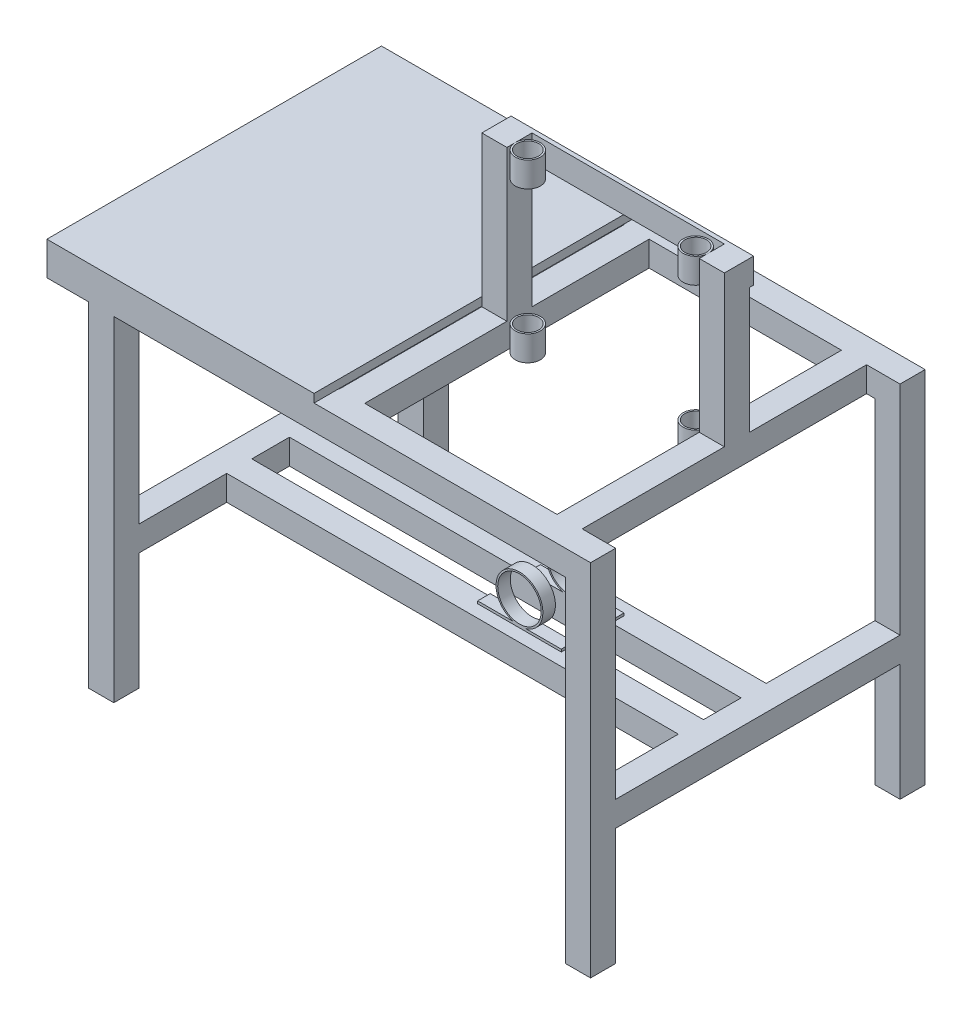
from build123d import *

# Parameters (mm, degrees)
SKETCH4_W              = 600
SKETCH4_H              = 400
SKETCH4_W_2            = 540
SKETCH4_H_2            = 340
BOSS_EXTRUDE2_DEPTH    = 30
SKETCH10_W             = 30
SKETCH10_H             = 30
BOSS_EXTRUDE7_DEPTH    = 370
SKETCH17_W             = 30
SKETCH17_H             = 30
BOSS_EXTRUDE13_DEPTH   = 500
SKETCH18_W             = 30
SKETCH18_H             = 30
BOSS_EXTRUDE14_DEPTH   = 370
SKETCH19_W             = 30
SKETCH19_H             = 30
BOSS_EXTRUDE15_DEPTH   = 570
SKETCH21_R             = 26
BOSS_EXTRUDE17_DEPTH   = 15
BOSS_EXTRUDE18_START   = -15
SKETCH22_R             = 26
BOSS_EXTRUDE18_DEPTH   = 15
SKETCH23_W             = 30
SKETCH23_H             = 30
CUT_EXTRUDE2_DEPTH     = 100
SKETCH27_W             = 30
SKETCH27_H             = 30
BOSS_EXTRUDE22_DEPTH   = 340
SKETCH28_W             = 30
SKETCH28_H             = 30
BOSS_EXTRUDE23_DEPTH   = 180
SKETCH31_R             = 15
SKETCH31_R_2           = 13
BOSS_EXTRUDE24_DEPTH   = 30
BOSS_EXTRUDE24_2_DEPTH = 30
SKETCH34_R             = 15
SKETCH34_R_2           = 13
BOSS_EXTRUDE25_DEPTH   = 30
BOSS_EXTRUDE25_2_DEPTH = 30
SKETCH35_W             = 30
SKETCH35_H             = 30
CUT_EXTRUDE3_DEPTH     = 340
SKETCH36_W             = 30
SKETCH36_H             = 30
CUT_EXTRUDE4_DEPTH     = 340
SKETCH37_W             = 30
SKETCH37_H             = 30
BOSS_EXTRUDE26_DEPTH   = 50
SKETCH38_W             = 30
SKETCH38_H             = 30
BOSS_EXTRUDE27_DEPTH   = 340
SKETCH39_W             = 319.396071149
SKETCH39_H             = 400
BOSS_EXTRUDE28_DEPTH   = 10
SKETCH42_W             = 290
SKETCH42_H             = 30
BOSS_EXTRUDE31_DEPTH   = 5


with BuildPart() as part:
    # Sketch4 → Boss-Extrude2 (new body)
    with BuildSketch(Plane(origin=(0, 0, 0), x_dir=(1, 0, 0), z_dir=(0, 1, 0))):
        Rectangle(SKETCH4_W, SKETCH4_H)
        Rectangle(SKETCH4_W_2, SKETCH4_H_2, mode=Mode.SUBTRACT)
    extrude(amount=BOSS_EXTRUDE2_DEPTH)

    # Sketch10 → Boss-Extrude7 (add)
    with BuildSketch(Plane.XY.offset(200)):
        with Locations((-15, 15)):
            Rectangle(SKETCH10_W, SKETCH10_H)
    extrude(amount=-BOSS_EXTRUDE7_DEPTH)

    # Sketch17 → Boss-Extrude13 (add)
    with BuildSketch(Plane.XZ):
        with Locations((-285, 185)):
            Rectangle(SKETCH17_W, SKETCH17_H)
        with Locations((285, 185)):
            Rectangle(SKETCH17_W, SKETCH17_H)
        with Locations((285, -185)):
            Rectangle(SKETCH17_W, SKETCH17_H)
        with Locations((-285, -185)):
            Rectangle(SKETCH17_W, SKETCH17_H)
    extrude(amount=BOSS_EXTRUDE13_DEPTH)

    # Sketch18 → Boss-Extrude14 (add)
    with BuildSketch(Plane.XY.offset(200)):
        with Locations((285, -245)):
            Rectangle(SKETCH18_W, SKETCH18_H)
        with Locations((-285, -245)):
            Rectangle(SKETCH18_W, SKETCH18_H)
    extrude(amount=-BOSS_EXTRUDE14_DEPTH)

    # Sketch19 → Boss-Extrude15 (add)
    with BuildSketch(Plane.ZY.offset(300)):
        with Locations((-25, -245)):
            Rectangle(SKETCH19_W, SKETCH19_H)
        with Locations((50, -245)):
            Rectangle(SKETCH19_W, SKETCH19_H)
    extrude(amount=-BOSS_EXTRUDE15_DEPTH)

    # Sketch21 → Boss-Extrude17 (add)
    with BuildSketch(Plane.XY.offset(-10)):
        with BuildLine():
            Line((72.416198487, -227), (115, -227))
            Line((115, -227), (115, -233))
            Line((115, -233), (15, -233))
            Line((15, -233), (15, -227))
            Line((15, -227), (57.583801513, -227))
            ThreePointArc((57.583801513, -227), (65, -172), (72.416198487, -227))
        make_face()
        with Locations((65, -200)):
            Circle(SKETCH21_R, mode=Mode.SUBTRACT)
    extrude(amount=-BOSS_EXTRUDE17_DEPTH)

    # Sketch22 → Boss-Extrude18 (add)
    with BuildSketch(Plane(origin=(0, 0, 35), x_dir=(-1, 0, 0), z_dir=(0, 0, -1)).offset(BOSS_EXTRUDE18_START)):
        with BuildLine():
            Line((-57.583801513, -227), (-15, -227))
            Line((-15, -227), (-15, -230))
            Line((-15, -230), (-115, -230))
            Line((-115, -230), (-115, -227))
            Line((-115, -227), (-72.416198487, -227))
            ThreePointArc((-72.416198487, -227), (-65, -172), (-57.583801513, -227))
        make_face()
        with Locations(Location((-65, -200, 0), (0, 0, 180))):
            Circle(SKETCH22_R, mode=Mode.SUBTRACT)
    extrude(amount=BOSS_EXTRUDE18_DEPTH)

    # Sketch23 → Cut-Extrude2 (cut)
    with BuildSketch(Plane.XZ.offset(500)):
        with Locations((-285, 185)):
            Rectangle(SKETCH23_W, SKETCH23_H)
        with Locations((285, 185)):
            Rectangle(SKETCH23_W, SKETCH23_H)
        with Locations((285, -185)):
            Rectangle(SKETCH23_W, SKETCH23_H)
        with Locations((-285, -185)):
            Rectangle(SKETCH23_W, SKETCH23_H)
    extrude(amount=-CUT_EXTRUDE2_DEPTH, mode=Mode.SUBTRACT)

    # Sketch27 → Boss-Extrude22 (add)
    with BuildSketch(Plane.XY.offset(-170)):
        with Locations((245, 15)):
            Rectangle(SKETCH27_W, SKETCH27_H)
    extrude(amount=BOSS_EXTRUDE22_DEPTH)

    # Sketch28 → Boss-Extrude23 (add)
    with BuildSketch(Plane(origin=(0, 30, 0), x_dir=(1, 0, 0), z_dir=(0, 1, 0))):
        with Locations((-15, 15)):
            Rectangle(SKETCH28_W, SKETCH28_H)
        with Locations((245, 15)):
            Rectangle(SKETCH28_W, SKETCH28_H)
    extrude(amount=BOSS_EXTRUDE23_DEPTH)

    # Sketch35 → Cut-Extrude3 (cut)
    with BuildSketch(Plane.XY.offset(-170)):
        with Locations((285, 15)):
            Rectangle(SKETCH35_W, SKETCH35_H)
    extrude(amount=CUT_EXTRUDE3_DEPTH, mode=Mode.SUBTRACT)

    # Sketch36 → Cut-Extrude4 (cut)
    with BuildSketch(Plane.XY.offset(-170)):
        with Locations((-285, 15)):
            Rectangle(SKETCH36_W, SKETCH36_H)
    extrude(amount=CUT_EXTRUDE4_DEPTH, mode=Mode.SUBTRACT)

    # Sketch37 → Boss-Extrude26 (add)
    with BuildSketch(Plane.ZY.offset(300)):
        with Locations((-185, 15)):
            Rectangle(SKETCH37_W, SKETCH37_H)
        with Locations((185, 15)):
            Rectangle(SKETCH37_W, SKETCH37_H)
    extrude(amount=BOSS_EXTRUDE26_DEPTH)

    # Sketch38 → Boss-Extrude27 (add)
    with BuildSketch(Plane.XY.offset(-170)):
        with Locations((-335, 15)):
            Rectangle(SKETCH38_W, SKETCH38_H)
    extrude(amount=BOSS_EXTRUDE27_DEPTH)

    # Sketch39 → Boss-Extrude28 (add)
    with BuildSketch(Plane(origin=(0, 30, 0), x_dir=(1, 0, 0), z_dir=(0, 1, 0))):
        with Locations((-190.301964425, 0)):
            Rectangle(SKETCH39_W, SKETCH39_H)
    extrude(amount=BOSS_EXTRUDE28_DEPTH)

    # Sketch42 → Boss-Extrude31 (add)
    with BuildSketch(Plane(origin=(0, 0, -30), x_dir=(-1, 0, 0), z_dir=(0, 0, -1))):
        with Locations((-115, 195)):
            Rectangle(SKETCH42_W, SKETCH42_H)
    extrude(amount=BOSS_EXTRUDE31_DEPTH)


with BuildPart() as body_2:
    # Sketch31 → Boss-Extrude24 (new body)
    with BuildSketch(Plane.XZ):
        with Locations(Location((15, -10, 0), (0, 0, 270))):
            Circle(SKETCH31_R)
        with Locations(Location((15, -10, 0), (0, 0, 270))):
            Circle(SKETCH31_R_2, mode=Mode.SUBTRACT)
    extrude(amount=-BOSS_EXTRUDE24_DEPTH)


with BuildPart() as body_3:
    # Sketch31 → Boss-Extrude24 2 (new body)
    with BuildSketch(Plane.XZ):
        with Locations(Location((215, -10.676344756, 0), (0, 0, 270))):
            Circle(SKETCH31_R)
        with Locations(Location((215, -10.676344756, 0), (0, 0, 270))):
            Circle(SKETCH31_R_2, mode=Mode.SUBTRACT)
    extrude(amount=-BOSS_EXTRUDE24_2_DEPTH)


with BuildPart() as body_4:
    # Sketch34 → Boss-Extrude25 (new body)
    with BuildSketch(Plane(origin=(0, 210, 0), x_dir=(1, 0, 0), z_dir=(0, 1, 0))):
        with Locations(Location((15, 10, 0), (0, 0, 270))):
            Circle(SKETCH34_R)
        with Locations(Location((15, 10, 0), (0, 0, 270))):
            Circle(SKETCH34_R_2, mode=Mode.SUBTRACT)
    extrude(amount=-BOSS_EXTRUDE25_DEPTH)


with BuildPart() as body_5:
    # Sketch34 → Boss-Extrude25 2 (new body)
    with BuildSketch(Plane(origin=(0, 210, 0), x_dir=(1, 0, 0), z_dir=(0, 1, 0))):
        with Locations(Location((215, 10.676344756, 0), (0, 0, 270))):
            Circle(SKETCH34_R)
        with Locations(Location((215, 10.676344756, 0), (0, 0, 270))):
            Circle(SKETCH34_R_2, mode=Mode.SUBTRACT)
    extrude(amount=-BOSS_EXTRUDE25_2_DEPTH)


solid = Compound([part.part, body_2.part, body_3.part, body_4.part, body_5.part])
